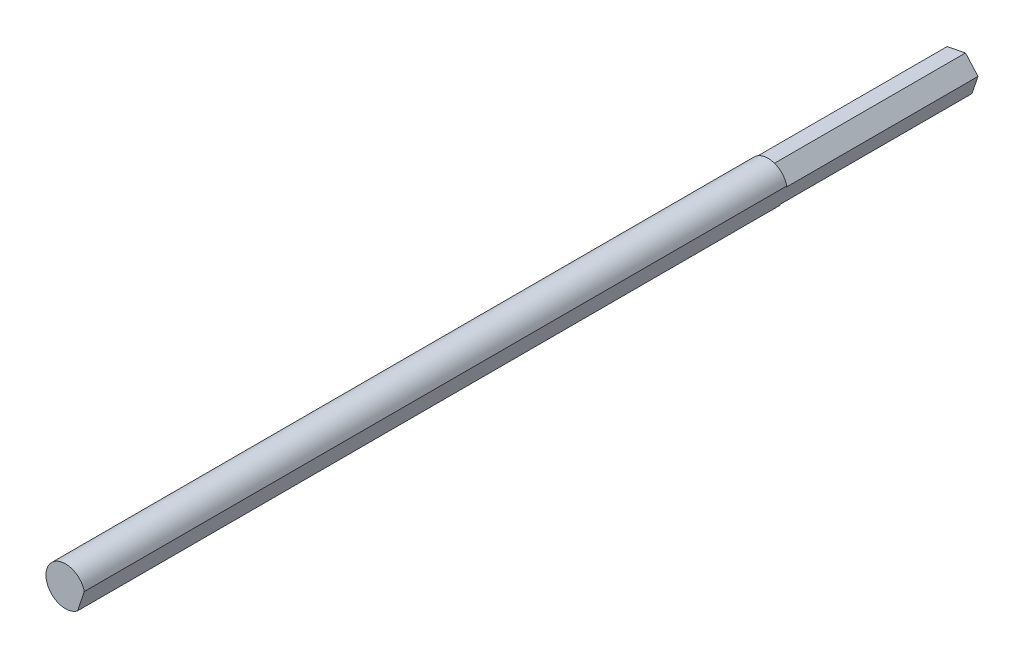
from build123d import *

# Parameters (mm, degrees)
SKETCH_1_R          = 3.05
EXTRUDE_1_DEPTH     = 110
EXTRUDE_2_DEPTH     = 30
SKETCH_3_W          = 148.461439859
SKETCH_3_H          = 21.991651446
CUT_EXTRUDE_1_DEPTH = 141.160128777


with BuildPart() as part:
    # 草图1 → 凸台-拉伸1 (new body)
    with BuildSketch(Plane.XY):
        Circle(SKETCH_1_R)
    extrude(amount=-EXTRUDE_1_DEPTH)

    # 草图2 → 凸台-拉伸2 (add)
    with BuildSketch(Plane(origin=(0, 0, -110), x_dir=(-1, 0, 0), z_dir=(0, 0, -1))):
        Polygon((1.953354878, 2.210634461), (-0.937788163, 2.796972178), (-2.891143041, 0.586337717), (-1.953354878, -2.210634461), (0.937788163, -2.796972178), (2.891143041, -0.586337717), align=None)
    extrude(amount=EXTRUDE_2_DEPTH)

    # 草图3 → 切除-拉伸1 (cut, through all)
    with BuildSketch(Plane(origin=(2.422248959, -0.812148372, 0), x_dir=(0, 0, -1), z_dir=(0.9481261618829849, -0.3178942924197286, 0))):
        with Locations((68.647762533, -0.511106719)):
            Rectangle(SKETCH_3_W, SKETCH_3_H)
    extrude(amount=CUT_EXTRUDE_1_DEPTH, mode=Mode.SUBTRACT)


solid = part.part
